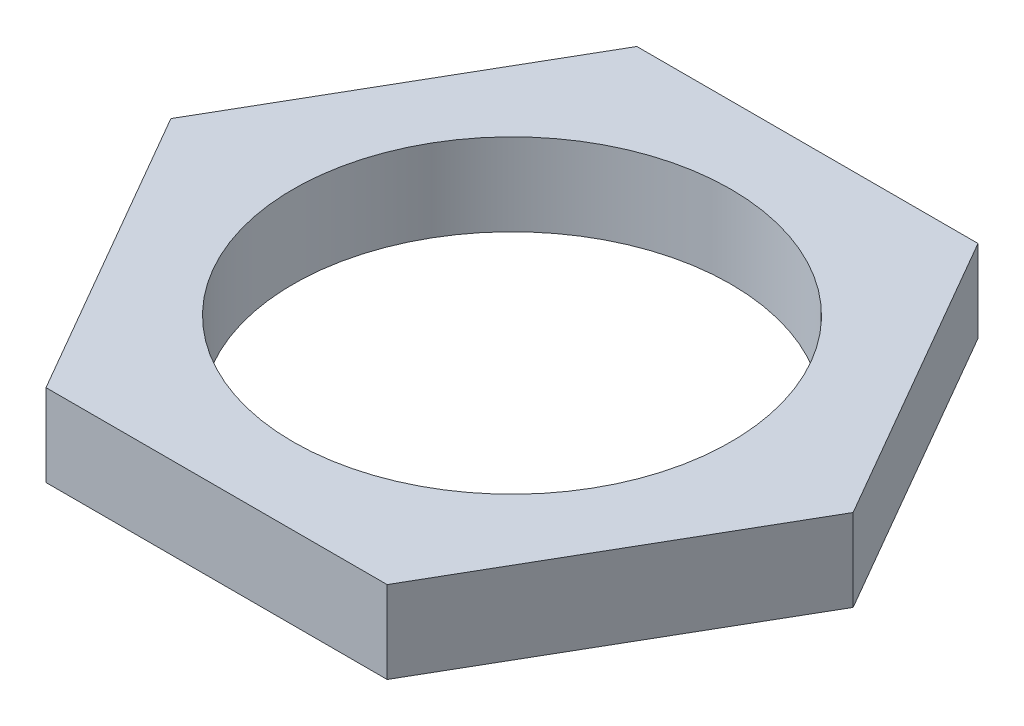
from build123d import *

# Parameters (mm, degrees)
NUT_DEPTH     = 3.2
BORE_SKETCH_W = 8.52
BORE_SKETCH_H = 5.2


with BuildPart() as part:
    # Nut Sketch → Nut (new body)
    with BuildSketch(Plane(origin=(0, 17.2, 0), x_dir=(1, 0, 0), z_dir=(0, 1, 0))):
        Polygon((13.279056191, 0), (6.639528096, 11.5), (-6.639528096, 11.5), (-13.279056191, 0), (-6.639528096, -11.5), (6.639528096, -11.5), align=None)
    extrude(amount=NUT_DEPTH)

    # Bore Sketch → Bore (revolve, cut)
    with BuildSketch(Plane.XY):
        with Locations((4.26, 18.8)):
            Rectangle(BORE_SKETCH_W, BORE_SKETCH_H)
    revolve(axis=Axis((0, -100, 0), (0, 1, 0)), mode=Mode.SUBTRACT)


solid = part.part
